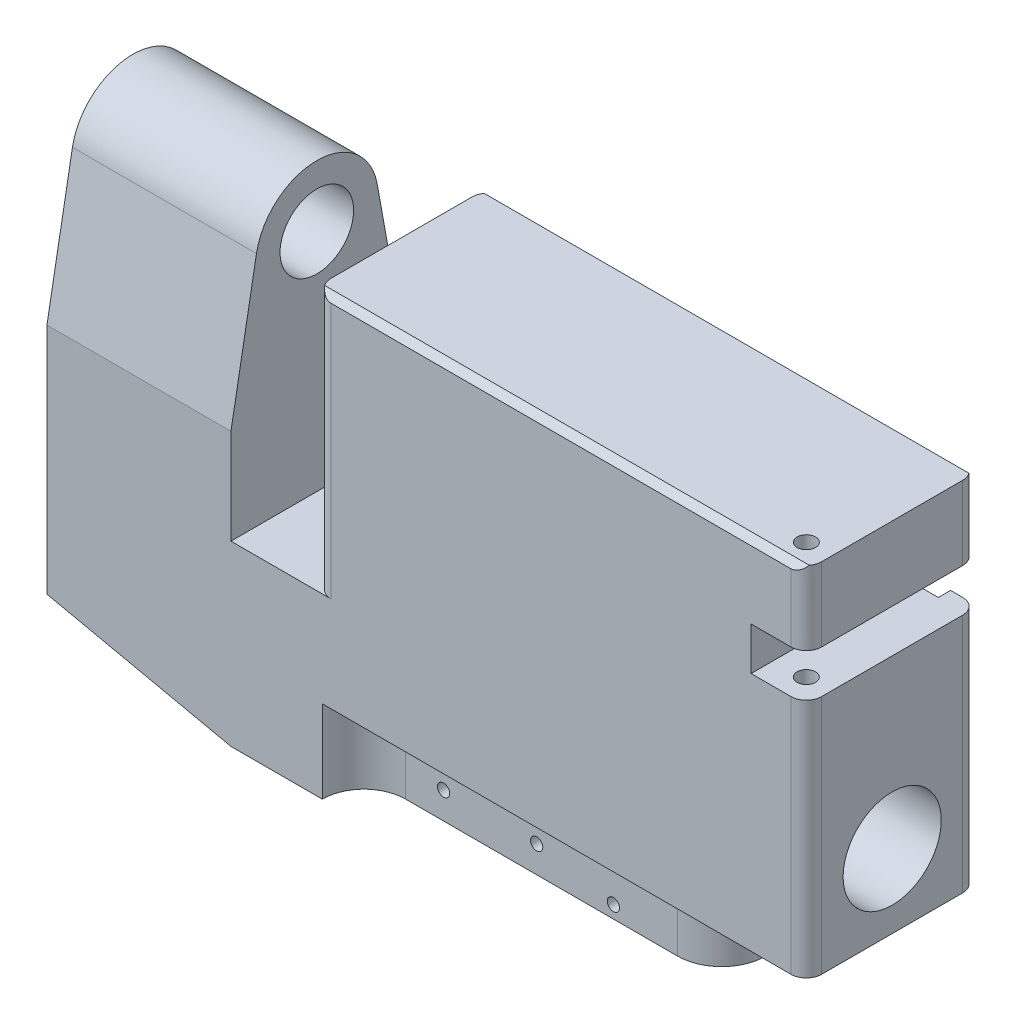
from build123d import *

# Parameters (mm, degrees)
SKETCH1_R                = 1
EXTRUDE1_DEPTH           = 14
CHAMFER1_SIZE            = 1
FILLET1_R                = 2.5
EXTRUDE4_DEPTH           = 30
SKETCH5_R                = 1.5
EXTRUDE5_DEPTH           = 23
SKETCH6_R                = 2.55
SKETCH6_R_2              = 2.05
EXTRUDE6_DEPTH           = 106.731109897
EXTRUDE7_REACH           = 123.359
EXTRUDE8_DEPTH           = 15.49
EXTRUDE21_DEPTH          = 10.11
SKETCH22_R               = 1.2
EXTRUDE22_DEPTH          = 113.348088101
EXTRUDE23_DEPTH          = 113.348088101
EXTRUDE23_DEPTH_BACK     = 8
SKETCH23_R               = 1.2
SKETCH12_R               = 1.5
EXTRUDE12_DEPTH          = 8.5
SKETCH13_R               = 2.5
EXTRUDE13_DEPTH          = 20.48
EXTRUDE14_REACH          = 107.731
EXTRUDE14_END_RADIUS     = 6
SKETCH14_R               = 2.25
SKETCH15_W               = 40.81
SKETCH15_H               = 5
EXTRUDE15_DEPTH          = 20
EXTRUDE24_DEPTH          = 19
EXTRUDE25_DEPTH          = 2
EXTRUDE26_DEPTH          = 5
SKETCH27_R               = 1.25
SKETCH27_R_2             = 1.1
SKETCH27_R_3             = 1
EXTRUDE27_DEPTH          = 6
SKETCH20_R               = 0.6
EXTRUDE20_DEPTH          = 8
CUT_EXTRUDE_1_REACH      = 114.06
CUT_EXTRUDE_1_END_RADIUS = 4.515
SKETCH_1_W               = 42.97
SKETCH_1_H               = 4.52


with BuildPart() as part:
    # Sketch1 → Extrude1 (new, symmetric)
    with BuildSketch(Plane.XY):
        Polygon((0, 0), (0, 46.74), (-30, 46.74), (-30, -22.49), (0, -28.98), (73.21, -28.98), (73.21, -15.51), (93.8, -15.51), (93.8, 23.71), (84.8, 23.71), (84.8, 30.71), (93.8, 30.71), (93.8, 42.75), (13.8, 42.75), (13.8, 0), align=None)
        with Locations((55.55, -17.96)):
            Circle(SKETCH1_R, mode=Mode.SUBTRACT)
        with Locations((55.55, -26.93)):
            Circle(SKETCH1_R, mode=Mode.SUBTRACT)
        with Locations((43.04, -24.61)):
            Circle(SKETCH1_R, mode=Mode.SUBTRACT)
        with Locations((27.87, -24.61)):
            Circle(SKETCH1_R, mode=Mode.SUBTRACT)
    extrude(amount=EXTRUDE1_DEPTH, both=True)

    # Chamfer1
    chamfer1_edges = [part.edges().sort_by_distance(p)[0] for p in [
        (53.8, 42.75, -14),
        (53.8, 42.75, 14),
    ]]
    chamfer(chamfer1_edges, length=CHAMFER1_SIZE)

    # Fillet1
    fillet1_edges = [part.edges().sort_by_distance(p)[0] for p in [
        (13.8, 20.875, -14),
        (93.8, 4.1, -14),
        (93.8, 36.23, -14),
        (93.8, 36.23, 14),
        (93.8, 4.1, 14),
        (13.8, 20.875, 14),
    ]]
    fillet(fillet1_edges, radius=FILLET1_R)

    # Sketch2 → Extrude4 (cut)
    with BuildSketch(Plane.ZY.offset(30)):
        with BuildLine():
            Line((-9.840360705, 38.519691323), (-14, 15.52))
            Line((-14, 15.52), (-14, 50.25246906))
            Line((-14, 50.25246906), (14, 50.25246906))
            Line((14, 50.25246906), (14, 15.52))
            Line((14, 15.52), (9.840360705, 38.519691323))
            ThreePointArc((9.840360705, 38.519691323), (0, 46.74), (-9.840360705, 38.519691323))
        make_face()
    extrude(amount=-EXTRUDE4_DEPTH, mode=Mode.SUBTRACT)

    # Sketch3 → Cut-Revolve1 (revolve, cut)
    with BuildSketch(Plane.XY):
        Polygon((-30, 36.73), (-30, 44.28), (-18.3, 44.28), (-18.3, 42.73), (0, 42.73), (0, 41.245), (13.8, 41.245), (85.68, 41.245), (85.68, 36.73), align=None)
    revolve(axis=Axis((85.68, 36.73, 0), (-1, 0, 0)), mode=Mode.SUBTRACT)

    # Sketch5 → Extrude5 (cut)
    with BuildSketch(Plane(origin=(0, 42.75, 0), x_dir=(1, 0, 0), z_dir=(0, 1, 0))):
        with Locations(Location((89.8, -10, 0), (0, 0, 180))):
            Circle(SKETCH5_R)
    extrude(amount=-EXTRUDE5_DEPTH, mode=Mode.SUBTRACT)

    # Sketch6 → Extrude6 (cut, through all)
    with BuildSketch(Plane(origin=(0, 0, 0), x_dir=(1, 0, 0), z_dir=(0, 1, 0))):
        with Locations(Location((-13.6, 0, 0), (0, 0, 270))):
            Circle(SKETCH6_R)
        with Locations(Location((-24.9, 0, 0), (0, 0, 270))):
            Circle(SKETCH6_R_2)
    extrude(amount=-EXTRUDE6_DEPTH, mode=Mode.SUBTRACT)

    # Extrude7: up to this face of the body (flat: up to its plane)
    extrude7_end = Plane(part.part.faces().sort_by_distance((83.459484326, -15.51, 0))[0])
    # Sketch7 → Extrude7 (cut, up to the picked face)
    with BuildSketch(Plane.XZ.offset(28.98), mode=Mode.PRIVATE) as extrude7_sk1:
        with BuildLine():
            Line((21.69, 7.2), (66.01, 7.2))
            ThreePointArc((66.01, 7.2), (73.21, 0), (66.01, -7.2))
            Line((66.01, -7.2), (21.69, -7.2))
            ThreePointArc((21.69, -7.2), (16.881673888, -9.191673888), (14.89, -14))
            Line((14.89, -14), (80.319549596, -14))
            Line((80.319549596, -14), (80.319549596, 14))
            Line((80.319549596, 14), (14.89, 14))
            ThreePointArc((14.89, 14), (16.881673888, 9.191673888), (21.69, 7.2))
        make_face()
    extrude7_tool1 = split(extrude(extrude7_sk1.sketch, amount=-EXTRUDE7_REACH, mode=Mode.PRIVATE), bisect_by=extrude7_end, keep=Keep.BOTH, mode=Mode.PRIVATE)
    add(extrude7_tool1.solids().sort_by(Axis((47.604775, -28.98, 13.28831), (0, 1, 0)))[0], mode=Mode.SUBTRACT)

    # Sketch8 → Extrude8 (cut)
    with BuildSketch(Plane.XZ.offset(28.98)):
        with BuildLine():
            Line((21.69, 5.2), (66.01, 5.2))
            ThreePointArc((66.01, 5.2), (71.21, 0), (66.01, -5.2))
            Line((66.01, -5.2), (21.69, -5.2))
            Line((21.69, -5.2), (21.69, 5.2))
        make_face()
    extrude(amount=-EXTRUDE8_DEPTH, mode=Mode.SUBTRACT)

    # Sketch9 → Extrude21 (cut)
    with BuildSketch(Plane.XZ.offset(28.98)):
        with BuildLine():
            Line((17.74, 5.2), (21.69, 5.2))
            Line((21.69, 5.2), (21.69, -5.2))
            Line((21.69, -5.2), (17.74, -5.2))
            ThreePointArc((17.74, -5.2), (13.574153864, -3.112189899), (12.753498359, 1.474720781))
            Line((12.753498359, 1.474720781), (10.23607572, 3.741418307))
            ThreePointArc((10.23607572, 3.741418307), (10.070232818, 6.90588939), (13.234703901, 7.071732292))
            Line((13.234703901, 7.071732292), (15.75212654, 4.805034766))
            ThreePointArc((15.75212654, 4.805034766), (16.726634514, 5.100302971), (17.74, 5.2))
        make_face()
    extrude(amount=-EXTRUDE21_DEPTH, mode=Mode.SUBTRACT)

    # Sketch22 → Extrude22 (cut, through all)
    with BuildSketch(Plane.XZ.offset(13.49)):
        with Locations(Location((17.74, 0, 0), (0, 0, 270))):
            Circle(SKETCH22_R)
    extrude(amount=EXTRUDE22_DEPTH, mode=Mode.SUBTRACT)

    # Sketch23 → Extrude23 (cut, two sides: drawn at the far end of the back side and taken through both)
    with BuildSketch(Plane.XZ.offset(13.49).offset(-EXTRUDE23_DEPTH_BACK)):
        with Locations(Location((11.73538981, 5.406575299, 0), (0, 0, 270))):
            Circle(SKETCH23_R)
    extrude(amount=EXTRUDE23_DEPTH + EXTRUDE23_DEPTH_BACK, mode=Mode.SUBTRACT)

    # Sketch12 → Extrude12 (cut)
    with BuildSketch(Plane(origin=(0, 0, 0), x_dir=(1, 0, 0), z_dir=(0, 1, 0))):
        with Locations(Location((9.63, 4.53, 0), (0, 0, 180))):
            Circle(SKETCH12_R)
    extrude(amount=-EXTRUDE12_DEPTH, mode=Mode.SUBTRACT)

    # Sketch13 → Extrude13 (cut)
    with BuildSketch(Plane.XZ.offset(28.98)):
        with Locations(Location((9.63, -4.53, 0), (0, 0, 270))):
            Circle(SKETCH13_R)
    extrude(amount=-EXTRUDE13_DEPTH, mode=Mode.SUBTRACT)

    # Extrude14: up to this cylinder (the profile starts outside it)
    extrude14_end = Plane(origin=(-13.6, 36.73, 0), z_dir=(1, 0, 0)) * Cylinder(EXTRUDE14_END_RADIUS, 228.462, mode=Mode.PRIVATE)
    # Sketch14 → Extrude14 (cut, up to the surface)
    with BuildSketch(Plane(origin=(0, 0, 0), x_dir=(1, 0, 0), z_dir=(0, 1, 0)), mode=Mode.PRIVATE) as extrude14_sk1:
        with Locations(Location((-13.6, 0, 0), (0, 0, 90))):
            Circle(SKETCH14_R)
    extrude14_tool1 = extrude(extrude14_sk1.sketch, amount=EXTRUDE14_REACH, mode=Mode.PRIVATE) - extrude14_end
    add(extrude14_tool1.solids().sort_by_distance((-13.6, 0, 0))[0], mode=Mode.SUBTRACT)

    # Sketch15 → Extrude15 (cut)
    with BuildSketch(Plane.XZ.offset(13.49)):
        with Locations((46.585, 0)):
            Rectangle(SKETCH15_W, SKETCH15_H)
    extrude(amount=-EXTRUDE15_DEPTH, mode=Mode.SUBTRACT)

    # Sketch24 → Extrude24 (cut)
    with BuildSketch(Plane(origin=(0, 0, -14), x_dir=(-1, 0, 0), z_dir=(0, 0, -1))):
        with BuildLine():
            Line((-84.8, 30.71), (-13.8, 30.71))
            Line((-13.8, 30.71), (-13.8, 6.5))
            Line((-13.8, 6.5), (-83.95, 6.5))
            ThreePointArc((-83.95, 6.5), (-86.332949853, 7.487050147), (-87.32, 9.87))
            Line((-87.32, 9.87), (-87.32, 15.96))
            ThreePointArc((-87.32, 15.96), (-86.716639969, 17.416639969), (-85.26, 18.02))
            Line((-85.26, 18.02), (-84.47, 18.02))
            ThreePointArc((-84.47, 18.02), (-83.27498954, 18.51498954), (-82.78, 19.71))
            Line((-82.78, 19.71), (-82.78, 23.71))
            Line((-82.78, 23.71), (-84.8, 23.71))
            Line((-84.8, 23.71), (-84.8, 30.71))
        make_face()
    extrude(amount=-EXTRUDE24_DEPTH, mode=Mode.SUBTRACT)

    # Sketch25 → Extrude25 (cut)
    with BuildSketch(Plane(origin=(0, 0, -14), x_dir=(-1, 0, 0), z_dir=(0, 0, -1))):
        with BuildLine():
            Line((-15.8, 6.5), (-15.8, 23.71))
            Line((-15.8, 23.71), (-89.32, 23.71))
            Line((-89.32, 23.71), (-89.32, 6.5))
            ThreePointArc((-89.32, 6.5), (-88.734213562, 5.085786438), (-87.32, 4.5))
            Line((-87.32, 4.5), (-17.8, 4.5))
            ThreePointArc((-17.8, 4.5), (-16.385786438, 5.085786438), (-15.8, 6.5))
        make_face()
        with BuildLine():
            Line((-17.8, 32.71), (-50.14, 32.71))
            ThreePointArc((-50.14, 32.71), (-51.554213562, 32.124213562), (-52.14, 30.71))
            Line((-52.14, 30.71), (-52.14, 28.71))
            Line((-52.14, 28.71), (-15.8, 28.71))
            Line((-15.8, 28.71), (-15.8, 30.71))
            ThreePointArc((-15.8, 30.71), (-16.385786438, 32.124213562), (-17.8, 32.71))
        make_face()
    extrude(amount=-EXTRUDE25_DEPTH, mode=Mode.SUBTRACT)

    # Sketch26 → Extrude26 (cut)
    with BuildSketch(Plane(origin=(0, 0, 5), x_dir=(-1, 0, 0), z_dir=(0, 0, -1))):
        with BuildLine():
            Line((-38.25, 30.71), (-68.47, 30.71))
            ThreePointArc((-68.47, 30.71), (-71.97, 27.21), (-68.47, 23.71))
            Line((-68.47, 23.71), (-38.25, 23.71))
            ThreePointArc((-38.25, 23.71), (-34.75, 27.21), (-38.25, 30.71))
        make_face()
    extrude(amount=-EXTRUDE26_DEPTH, mode=Mode.SUBTRACT)

    # Sketch4 → Cut-Revolve2 (revolve, cut)
    with BuildSketch(Plane.XY, mode=Mode.PRIVATE) as cut_revolve2_sk:
        Polygon((-32.954746832, 6.51), (-32.954746832, -3.49), (100.534470899, -3.49), (100.534470899, 4.51), (21.600016289, 4.51), (21.600016289, -0.99), (-1.117704794, -0.99), (-1.117704794, 6.51), align=None)
    revolve(cut_revolve2_sk.sketch.rotate(Axis((-36.156901719, -3.49, 0), (1, 0, 0)), 90), axis=Axis((-36.156901719, -3.49, 0), (1, 0, 0)), mode=Mode.SUBTRACT)

    # Sketch27 → Extrude27 (cut)
    with BuildSketch(Plane(origin=(0, 0, 5), x_dir=(-1, 0, 0), z_dir=(0, 0, -1))):
        with Locations((-65.64, 11.33)):
            Circle(SKETCH27_R)
        with Locations((-21.56, 26.46)):
            Circle(SKETCH27_R_2)
        with Locations((-85.26, 15.96)):
            Circle(SKETCH27_R_3)
        with Locations((-42.01, 11.33)):
            Circle(SKETCH27_R)
    extrude(amount=-EXTRUDE27_DEPTH, mode=Mode.SUBTRACT)

    # Sketch20 → Extrude20 (cut)
    with BuildSketch(Plane.XY.offset(-12)):
        with Locations((84.47, 19.71)):
            Circle(SKETCH20_R)
    extrude(amount=EXTRUDE20_DEPTH, mode=Mode.SUBTRACT)

    # 切除-拉伸1: up to this cylinder (the profile starts outside it)
    cut_extrude_1_end = Plane(origin=(57.535, 36.73, 0), z_dir=(1, 0, 0)) * Cylinder(CUT_EXTRUDE_1_END_RADIUS, 238.15, mode=Mode.PRIVATE)
    # 草图1 → 切除-拉伸1 (cut, up to the surface)
    with BuildSketch(Plane.XZ.offset(-30.71), mode=Mode.PRIVATE) as cut_extrude_1_sk1:
        with Locations((57.535, 0)):
            Rectangle(SKETCH_1_W, SKETCH_1_H)
    cut_extrude_1_tool1 = extrude(cut_extrude_1_sk1.sketch, amount=-CUT_EXTRUDE_1_REACH, mode=Mode.PRIVATE) - cut_extrude_1_end
    add(cut_extrude_1_tool1.solids().sort_by_distance((57.535, 30.71, 0))[0], mode=Mode.SUBTRACT)


solid = part.part
